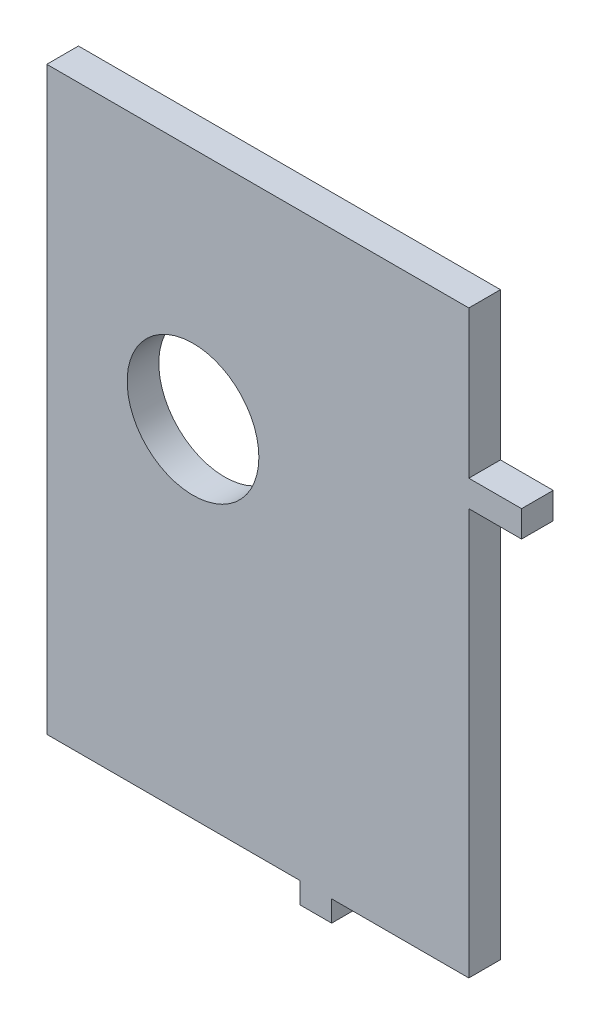
from build123d import *

# Parameters (mm, degrees)
SKETCH3_W           = 80
SKETCH3_H           = 110
BOSS_EXTRUDE1_DEPTH = 6
SKETCH4_W           = 6
SKETCH4_H           = 4
BOSS_EXTRUDE2_DEPTH = 6
SKETCH6_W           = 10
SKETCH6_H           = 5
BOSS_EXTRUDE3_DEPTH = 6
SKETCH8_R           = 12.4841
CUT_EXTRUDE1_DEPTH  = 6


with BuildPart() as part:
    # Sketch3 → Boss-Extrude1 (new body)
    with BuildSketch(Plane.XY):
        with Locations((40, 55)):
            Rectangle(SKETCH3_W, SKETCH3_H)
    extrude(amount=BOSS_EXTRUDE1_DEPTH)

    # Sketch4 → Boss-Extrude2 (add)
    with BuildSketch(Plane.XY.offset(6)):
        with Locations((51, -2)):
            Rectangle(SKETCH4_W, SKETCH4_H)
    extrude(amount=-BOSS_EXTRUDE2_DEPTH)

    # Sketch6 → Boss-Extrude3 (add)
    with BuildSketch(Plane.XY.offset(6)):
        with Locations((85, 79.55)):
            Rectangle(SKETCH6_W, SKETCH6_H)
    extrude(amount=-BOSS_EXTRUDE3_DEPTH)

    # Sketch8 → Cut-Extrude1 (cut)
    with BuildSketch(Plane.XY.offset(6)):
        with Locations((27.72, 65.58)):
            Circle(SKETCH8_R)
    extrude(amount=-CUT_EXTRUDE1_DEPTH, mode=Mode.SUBTRACT)


solid = part.part
